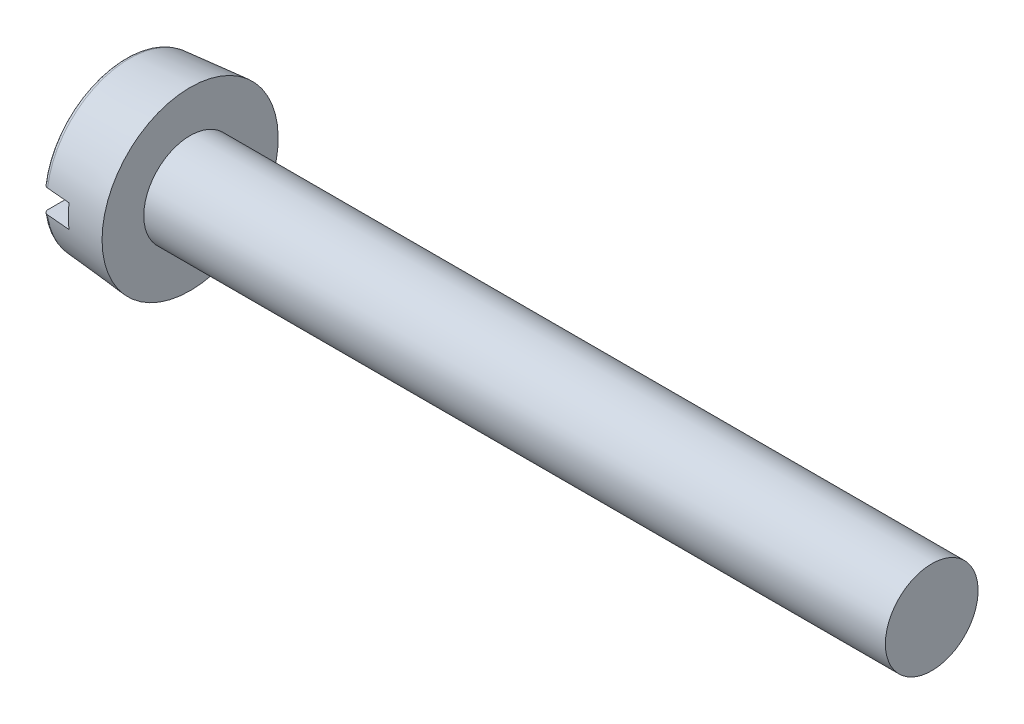
from build123d import *

# Parameters (mm, degrees)
FILLET2_R  = 0.1
SKETCH2_W  = 3.8
SKETCH2_H  = 0.5
SLOT_DEPTH = 0.6


with BuildPart() as part:
    # BodySke → Base-Revolve (revolve)
    with BuildSketch(Plane.XY, mode=Mode.PRIVATE) as base_revolve_sk:
        Polygon((1.4, 1), (1.4, 1.9), (0, 1.777515871), (0, 0), (17.4, 0), (17.4, 1), align=None)
    revolve(base_revolve_sk.sketch.rotate(Axis((-25.4, 0, 0), (1, 0, 0)), 90), axis=Axis((-25.4, 0, 0), (1, 0, 0)))

    # Fillet2
    fillet2_edges = [part.edges().sort_by_distance(p)[0] for p in [
        (0, 0, -1.777515871),
    ]]
    fillet(fillet2_edges, radius=FILLET2_R)

    # Sketch2 → Slot (cut)
    with BuildSketch(Plane(origin=(0, 0, 0), x_dir=(0, 0, -1), z_dir=(1, 0, 0))):
        Rectangle(SKETCH2_W, SKETCH2_H)
    extrude(amount=SLOT_DEPTH, mode=Mode.SUBTRACT)


solid = part.part
